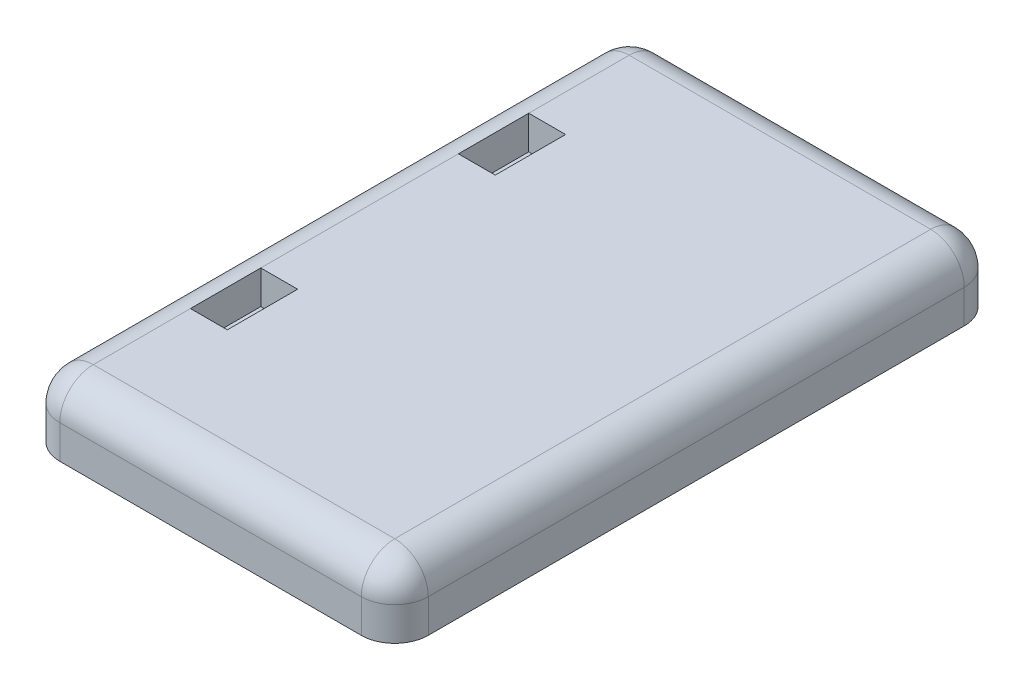
from build123d import *

# Parameters (mm, degrees)
SKETCH_2_W          = 55
SKETCH_2_H          = 90
EXTRUDE_1_DEPTH     = 10
FILLET_1_R          = 5
FILLET_2_R          = 5
FILLET_3_R          = 5
FILLET_4_R          = 5
SKETCH_3_W          = 5.5
SKETCH_3_H          = 10.5
CUT_EXTRUDE_1_DEPTH = 5


with BuildPart() as part:
    # 草图2 → 凸台-拉伸1 (new body)
    with BuildSketch(Plane(origin=(0, 0, 0), x_dir=(1, 0, 0), z_dir=(0, 1, 0))):
        Rectangle(SKETCH_2_W, SKETCH_2_H)
    extrude(amount=EXTRUDE_1_DEPTH)

    # 圆角1
    fillet_1_edges = [part.edges().sort_by_distance(p)[0] for p in [
        (-27.5, 10, 0),
    ]]
    fillet(fillet_1_edges, radius=FILLET_1_R)

    # 圆角2
    fillet_2_edges = [part.edges().sort_by_distance(p)[0] for p in [
        (-27.5, 2.5, -45),
        (-26.035533906, 8.535533906, -45),
        (2.5, 10, -45),
    ]]
    fillet(fillet_2_edges, radius=FILLET_2_R)

    # 圆角3
    fillet_3_edges = [part.edges().sort_by_distance(p)[0] for p in [
        (27.5, 2.5, -45),
        (27.5, 8.535533906, -43.535533906),
        (27.5, 10, 2.5),
    ]]
    fillet(fillet_3_edges, radius=FILLET_3_R)

    # 圆角4
    fillet_4_edges = [part.edges().sort_by_distance(p)[0] for p in [
        (0, 10, 45),
        (-27.5, 2.5, 45),
        (-26.035533906, 8.535533906, 45),
        (27.5, 2.5, 45),
        (26.035533906, 8.535533906, 45),
    ]]
    fillet(fillet_4_edges, radius=FILLET_4_R)

    # 草图3 → 切除-拉伸1 (cut)
    with BuildSketch(Plane(origin=(0, 10, 0), x_dir=(1, 0, 0), z_dir=(0, 1, 0))):
        with Locations((-19.75, 19.75)):
            Rectangle(SKETCH_3_W, SKETCH_3_H)
        with Locations((-19.75, -20.25)):
            Rectangle(SKETCH_3_W, SKETCH_3_H)
    extrude(amount=-CUT_EXTRUDE_1_DEPTH, mode=Mode.SUBTRACT)


solid = part.part
